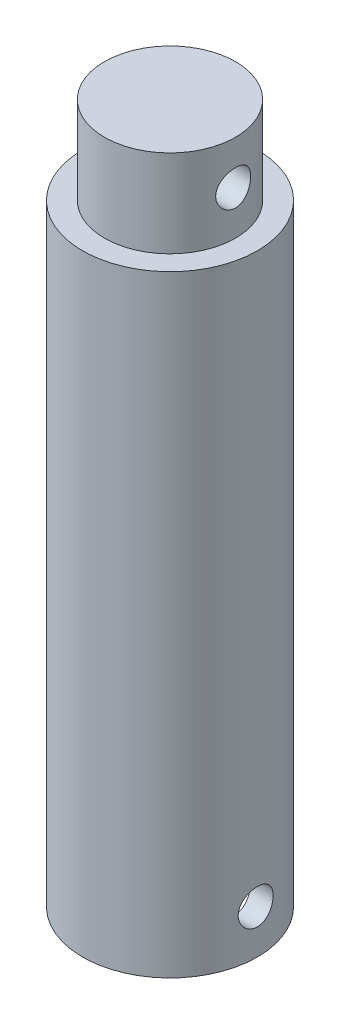
from build123d import *

# Parameters (mm, degrees)
SKETCH2_R               = 10
BOSS_EXTRUDE1_DEPTH     = 30
CUT_EXTRUDE1_START      = -10
SKETCH3_R               = 10
SKETCH3_R_2             = 7.5
CUT_EXTRUDE1_DEPTH      = 10
CUT_EXTRUDE3_DEPTH      = 10
CUT_EXTRUDE3_DEPTH_BACK = 10
SKETCH5_R               = 2
FILLET2_R               = 10
BOSS_EXTRUDE2_START     = -67.5
SKETCH7_R               = 10
BOSS_EXTRUDE2_DEPTH     = 67.5
SKETCH8_R               = 50
SKETCH8_R_2             = 10
CUT_EXTRUDE6_DEPTH      = 107.770782567
SKETCH9_R               = 7.5
CUT_EXTRUDE7_DEPTH      = 10
CUT_EXTRUDE8_DEPTH      = 10
CUT_EXTRUDE8_DEPTH_BACK = 10
SKETCH10_R              = 2


with BuildPart() as part:
    # Sketch1 → Revolve1 (revolve)
    with BuildSketch(Plane.XY):
        Polygon((50, 25), (0, 25), (0, 22.5), (45, 22.5), (45, -22.5), (0, -22.5), (0, -25), (50, -25), align=None)
    revolve(axis=Axis((0, -25, 0), (0, 1, 0)))

    # Sketch2 → Boss-Extrude1 (add)
    with BuildSketch(Plane(origin=(0, 25, 0), x_dir=(1, 0, 0), z_dir=(0, 1, 0))):
        with Locations(Location((0, 0, 0), (0, 0, 180))):
            Circle(SKETCH2_R)
    extrude(amount=BOSS_EXTRUDE1_DEPTH)

    # Sketch3 → Cut-Extrude1 (cut)
    with BuildSketch(Plane(origin=(0, 55, 0), x_dir=(1, 0, 0), z_dir=(0, 1, 0)).offset(CUT_EXTRUDE1_START)):
        with Locations(Location((0, 0, 0), (0, 0, 180))):
            Circle(SKETCH3_R)
        with Locations(Location((0, 0, 0), (0, 0, 180))):
            Circle(SKETCH3_R_2, mode=Mode.SUBTRACT)
    extrude(amount=CUT_EXTRUDE1_DEPTH, mode=Mode.SUBTRACT)

    # Sketch5 → Cut-Extrude3 (cut, two sides: drawn at the far end of the back side and taken through both)
    with BuildSketch(Plane(origin=(0, 0, 0), x_dir=(0, 0, -1), z_dir=(1, 0, 0)).offset(-CUT_EXTRUDE3_DEPTH_BACK)):
        with Locations(Location((0, 50, 0), (0, 0, 180))):
            Circle(SKETCH5_R)
    extrude(amount=CUT_EXTRUDE3_DEPTH + CUT_EXTRUDE3_DEPTH_BACK, mode=Mode.SUBTRACT)

    # Fillet2
    fillet2_edges = [part.edges().sort_by_distance(p)[0] for p in [
        (-50, 25, 0),
    ]]
    fillet(fillet2_edges, radius=FILLET2_R)

    # Sketch7 → Boss-Extrude2 (add)
    with BuildSketch(Plane(origin=(0, 45, 0), x_dir=(1, 0, 0), z_dir=(0, 1, 0)).offset(BOSS_EXTRUDE2_START)):
        with Locations(Location((0, 0, 0), (0, 0, 180))):
            Circle(SKETCH7_R)
    extrude(amount=BOSS_EXTRUDE2_DEPTH)

    # Sketch8 → Cut-Extrude6 (cut, through all)
    with BuildSketch(Plane(origin=(0, 55, 0), x_dir=(1, 0, 0), z_dir=(0, 1, 0))):
        Circle(SKETCH8_R)
        with Locations(Location((0, 0, 0), (0, 0, 180))):
            Circle(SKETCH8_R_2, mode=Mode.SUBTRACT)
    extrude(amount=-CUT_EXTRUDE6_DEPTH, mode=Mode.SUBTRACT)

    # Sketch9 → Cut-Extrude7 (cut)
    with BuildSketch(Plane.XZ.offset(25)):
        with Locations(Location((0, 0, 0), (0, 0, 180))):
            Circle(SKETCH9_R)
    extrude(amount=-CUT_EXTRUDE7_DEPTH, mode=Mode.SUBTRACT)

    # Sketch10 → Cut-Extrude8 (cut, two sides: drawn at the far end of the back side and taken through both)
    with BuildSketch(Plane(origin=(0, 0, 0), x_dir=(0, 0, -1), z_dir=(1, 0, 0)).offset(-CUT_EXTRUDE8_DEPTH_BACK)):
        with Locations(Location((0, -20, 0), (0, 0, 180))):
            Circle(SKETCH10_R)
    extrude(amount=CUT_EXTRUDE8_DEPTH + CUT_EXTRUDE8_DEPTH_BACK, mode=Mode.SUBTRACT)


solid = part.part
